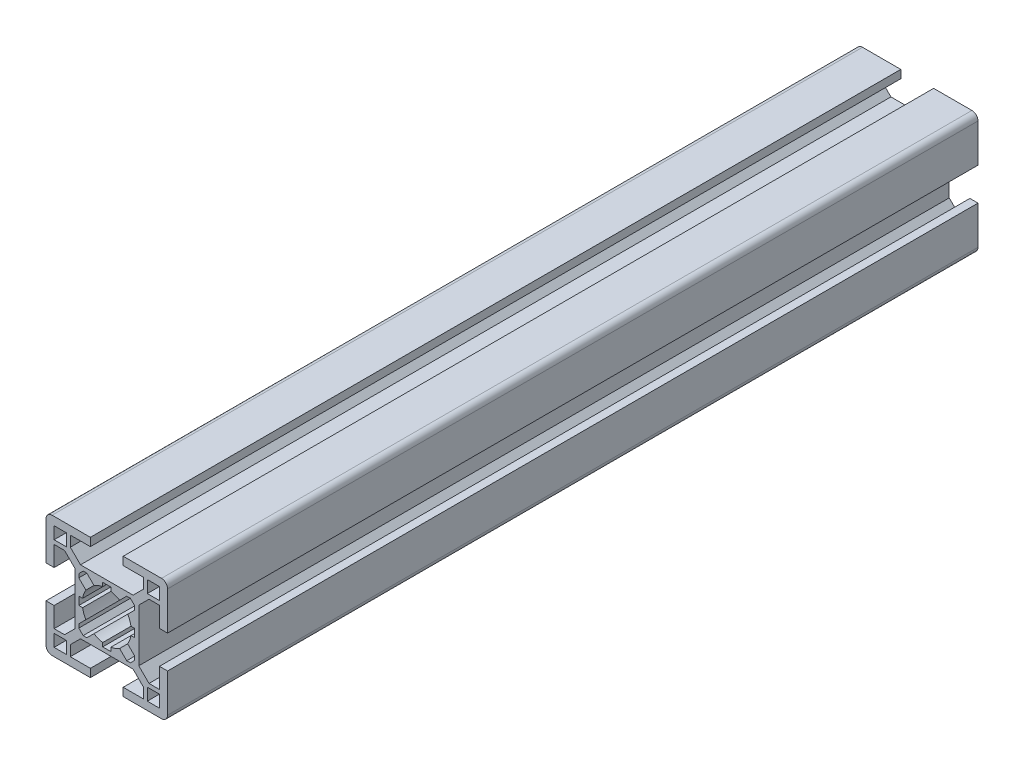
from build123d import *

# Parameters (mm, degrees)
ESBO_O1_W                = 3
ESBO_O1_H                = 3
RESSALTO_EXTRUS_O1_DEPTH = 100


with BuildPart() as part:
    # Esboço1 → Ressalto-extrusão1 (new, symmetric)
    with BuildSketch(Plane.XY):
        with BuildLine():
            Line((15, 13.5), (15, 4.05))
            Line((15, 4.05), (13, 4.05))
            Line((13, 4.05), (13, 9))
            Line((13, 9), (10.414213562, 9))
            Line((10.414213562, 9), (7.9, 6.485786438))
            Line((7.9, 6.485786438), (7.9, -7.36e-07))
            Line((7.9, -7.36e-07), (7.9, -6.485786438))
            Line((7.9, -6.485786438), (10.414213562, -9))
            Line((10.414213562, -9), (13, -9))
            Line((13, -9), (13, -4.05))
            Line((13, -4.05), (15, -4.05))
            Line((15, -4.05), (15, -13.5))
            ThreePointArc((15, -13.5), (14.560660172, -14.560660172), (13.5, -15))
            Line((13.5, -15), (4.05, -15))
            Line((4.05, -15), (4.05, -13))
            Line((4.05, -13), (9, -13))
            Line((9, -13), (9, -10.414213562))
            Line((9, -10.414213562), (6.485786438, -7.9))
            Line((6.485786438, -7.9), (-7.36e-07, -7.9))
            Line((-7.36e-07, -7.9), (-6.485786438, -7.9))
            Line((-6.485786438, -7.9), (-9, -10.414213562))
            Line((-9, -10.414213562), (-9, -13))
            Line((-9, -13), (-4.05, -13))
            Line((-4.05, -13), (-4.05, -15))
            Line((-4.05, -15), (-13.5, -15))
            ThreePointArc((-13.5, -15), (-14.560660172, -14.560660172), (-15, -13.5))
            Line((-15, -13.5), (-15, -4.05))
            Line((-15, -4.05), (-13, -4.05))
            Line((-13, -4.05), (-13, -9))
            Line((-13, -9), (-10.414213562, -9))
            Line((-10.414213562, -9), (-7.9, -6.485786438))
            Line((-7.9, -6.485786438), (-7.9, 7.36e-07))
            Line((-7.9, 7.36e-07), (-7.9, 6.485786438))
            Line((-7.9, 6.485786438), (-10.414213562, 9))
            Line((-10.414213562, 9), (-13, 9))
            Line((-13, 9), (-13, 4.05))
            Line((-13, 4.05), (-15, 4.05))
            Line((-15, 4.05), (-15, 13.5))
            ThreePointArc((-15, 13.5), (-14.560660172, 14.560660172), (-13.5, 15))
            Line((-13.5, 15), (-4.05, 15))
            Line((-4.05, 15), (-4.05, 13))
            Line((-4.05, 13), (-9, 13))
            Line((-9, 13), (-9, 10.414213562))
            Line((-9, 10.414213562), (-6.485786438, 7.9))
            Line((-6.485786438, 7.9), (7.36e-07, 7.9))
            Line((7.36e-07, 7.9), (6.485786438, 7.9))
            Line((6.485786438, 7.9), (9, 10.414213562))
            Line((9, 10.414213562), (9, 13))
            Line((9, 13), (4.05, 13))
            Line((4.05, 13), (4.05, 15))
            Line((4.05, 15), (13.5, 15))
            ThreePointArc((13.5, 15), (14.560660172, 14.560660172), (15, 13.5))
        make_face()
        with Locations((-11.5, 11.5)):
            Rectangle(ESBO_O1_W, ESBO_O1_H, mode=Mode.SUBTRACT)
        with BuildLine():
            Line((-6.9, 1.000000736), (-6.9, 7.36e-07))
            Line((-6.9, 7.36e-07), (-6.9, -1.000000736))
            Line((-6.9, -1.000000736), (-5.966782929, -1.000000736))
            ThreePointArc((-5.966782929, -1.000000736), (-5.665339038, -2.122836212), (-5.154690025, -3.167281286))
            Line((-5.154690025, -3.167281286), (-6.9, -4.91259126))
            Line((-6.9, -4.91259126), (-6.9, -5.827922061))
            Line((-6.9, -5.827922061), (-5.827922061, -6.9))
            Line((-5.827922061, -6.9), (-4.91259126, -6.9))
            Line((-4.91259126, -6.9), (-3.167281286, -5.154690025))
            ThreePointArc((-3.167281286, -5.154690025), (-2.122836212, -5.665339038), (-1.000000736, -5.966782929))
            Line((-1.000000736, -5.966782929), (-1.000000736, -6.9))
            Line((-1.000000736, -6.9), (-7.36e-07, -6.9))
            Line((-7.36e-07, -6.9), (1.000000736, -6.9))
            Line((1.000000736, -6.9), (1.000000736, -5.966782929))
            ThreePointArc((1.000000736, -5.966782929), (2.122836212, -5.665339038), (3.167281286, -5.154690025))
            Line((3.167281286, -5.154690025), (4.91259126, -6.9))
            Line((4.91259126, -6.9), (5.827922061, -6.9))
            Line((5.827922061, -6.9), (6.9, -5.827922061))
            Line((6.9, -5.827922061), (6.9, -4.91259126))
            Line((6.9, -4.91259126), (5.154690025, -3.167281286))
            ThreePointArc((5.154690025, -3.167281286), (5.665339038, -2.122836212), (5.966782929, -1.000000736))
            Line((5.966782929, -1.000000736), (6.9, -1.000000736))
            Line((6.9, -1.000000736), (6.9, -7.36e-07))
            Line((6.9, -7.36e-07), (6.9, 1.000000736))
            Line((6.9, 1.000000736), (5.966782929, 1.000000736))
            ThreePointArc((5.966782929, 1.000000736), (5.665339038, 2.122836212), (5.154690025, 3.167281286))
            Line((5.154690025, 3.167281286), (6.9, 4.91259126))
            Line((6.9, 4.91259126), (6.9, 5.827922061))
            Line((6.9, 5.827922061), (5.827922061, 6.9))
            Line((5.827922061, 6.9), (4.91259126, 6.9))
            Line((4.91259126, 6.9), (3.167281286, 5.154690025))
            ThreePointArc((3.167281286, 5.154690025), (2.122836212, 5.665339038), (1.000000736, 5.966782929))
            Line((1.000000736, 5.966782929), (1.000000736, 6.9))
            Line((1.000000736, 6.9), (7.36e-07, 6.9))
            Line((7.36e-07, 6.9), (-1.000000736, 6.9))
            Line((-1.000000736, 6.9), (-1.000000736, 5.966782929))
            ThreePointArc((-1.000000736, 5.966782929), (-2.122836212, 5.665339038), (-3.167281286, 5.154690025))
            Line((-3.167281286, 5.154690025), (-4.91259126, 6.9))
            Line((-4.91259126, 6.9), (-5.827922061, 6.9))
            Line((-5.827922061, 6.9), (-6.9, 5.827922061))
            Line((-6.9, 5.827922061), (-6.9, 4.91259126))
            Line((-6.9, 4.91259126), (-5.154690025, 3.167281286))
            ThreePointArc((-5.154690025, 3.167281286), (-5.665339038, 2.122836212), (-5.966782929, 1.000000736))
            Line((-5.966782929, 1.000000736), (-6.9, 1.000000736))
        make_face(mode=Mode.SUBTRACT)
        with Locations((11.5, 11.5)):
            Rectangle(ESBO_O1_W, ESBO_O1_H, mode=Mode.SUBTRACT)
        with Locations((11.5, -11.5)):
            Rectangle(ESBO_O1_W, ESBO_O1_H, mode=Mode.SUBTRACT)
        with Locations((-11.5, -11.5)):
            Rectangle(ESBO_O1_W, ESBO_O1_H, mode=Mode.SUBTRACT)
    extrude(amount=RESSALTO_EXTRUS_O1_DEPTH, both=True)


solid = part.part
